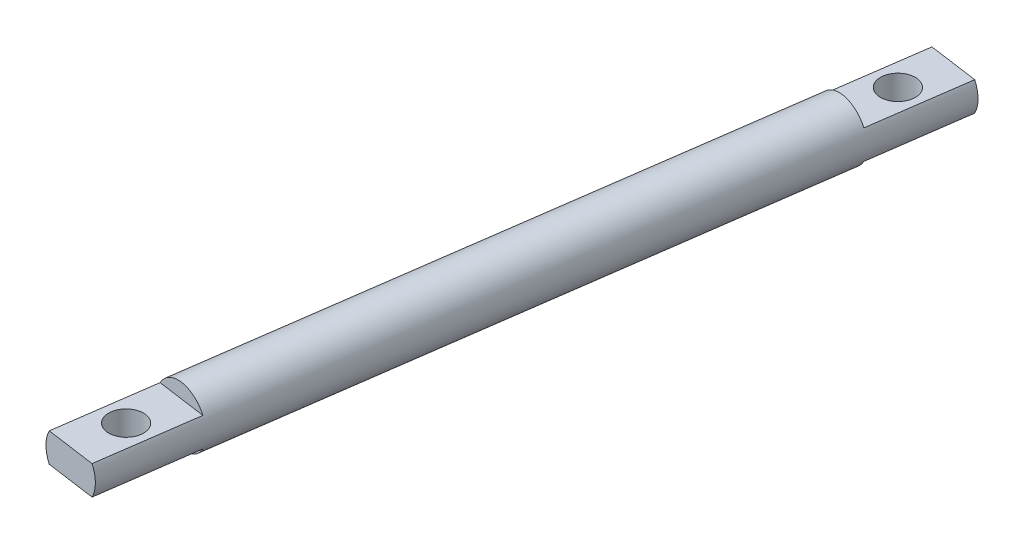
from build123d import *

# Parameters (mm, degrees)
SKETCH2_W          = 10.7315
SKETCH2_H          = 1.5875
CUT_EXTRUDE1_DEPTH = 93.498486906
SKETCH3_R          = 1.905
CUT_EXTRUDE2_DEPTH = 98.35226363


with BuildPart() as part:
    # Sketch1 → Revolve1 (revolve)
    with BuildSketch(Plane(origin=(0, -11.13590516, 0), x_dir=(1, 0, 0), z_dir=(0, 1, 0))):
        Polygon((-20.573060678, 7.9375), (-23.717125316, 8.37963409), (-21.338443913, 25.294701841), (-14.194693913, 76.094701841), (-11.816012511, 93.009769593), (-8.671947873, 92.567635503), align=None)
    revolve(axis=Axis((-14.194693913, -11.13590516, -76.094701841), (0.13925483139909506, 0, -0.9902565788380351)))

    # Sketch2 → Cut-Extrude1 (cut, symmetric)
    with BuildSketch(Plane(origin=(-24.412739892, 0, -3.433041547), x_dir=(0.13925483139909503, 0, -0.9902565788380351), z_dir=(0.9902565788380351, 0, 0.13925483139909503))):
        with Locations((10.361013498, -13.51715516)):
            Rectangle(SKETCH2_W, SKETCH2_H)
        with Locations((10.361013498, -8.75465516)):
            Rectangle(SKETCH2_W, SKETCH2_H)
    cut_extrude1 = extrude(amount=CUT_EXTRUDE1_DEPTH, both=True, mode=Mode.SUBTRACT)

    # Sketch3 → Cut-Extrude2 (cut, through all)
    with BuildSketch(Plane.XZ.offset(12.72340516)):
        with Locations(Location((-22.969918704, -13.693103328, 0), (0, 0, 270))):
            Circle(SKETCH3_R)
    cut_extrude2 = extrude(amount=-CUT_EXTRUDE2_DEPTH, mode=Mode.SUBTRACT)

    # Mirror1: Cut-Extrude1, Cut-Extrude2 across plane
    add(cut_extrude1.mirror(Plane(origin=(6.646170979, 0, -47.261660294), x_dir=(0.9902565788380351, 0, 0.13925483139909509), z_dir=(-0.13925483139909509, 0, 0.9902565788380352))), mode=Mode.SUBTRACT)
    add(cut_extrude2.mirror(Plane(origin=(6.646170979, 0, -47.261660294), x_dir=(0.9902565788380351, 0, 0.13925483139909509), z_dir=(-0.13925483139909509, 0, 0.9902565788380352))), mode=Mode.SUBTRACT)


solid = part.part
